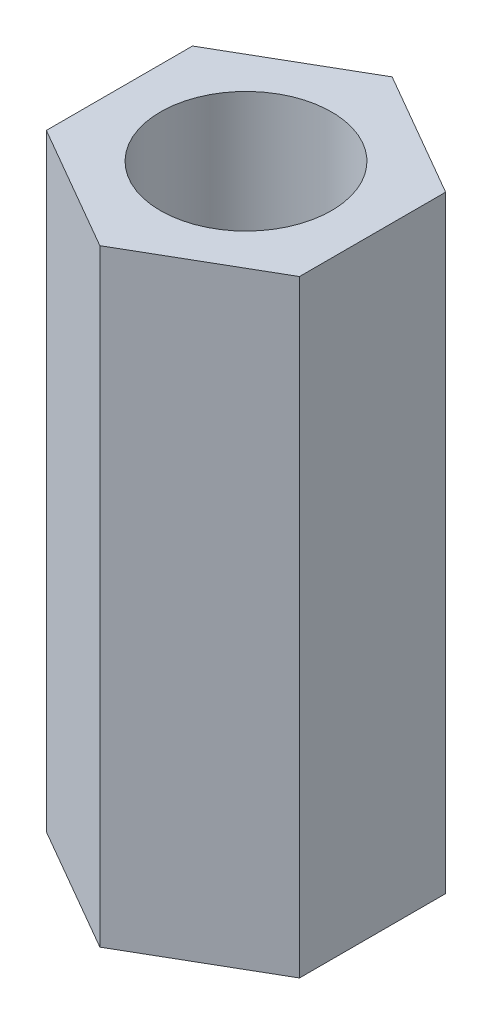
from build123d import *

# Parameters (mm, degrees)
SKETCH2_R           = 1.69
BOSS_EXTRUDE1_DEPTH = 12


with BuildPart() as part:
    # Sketch2 → Boss-Extrude1 (new body)
    with BuildSketch(Plane(origin=(0, 0, 0), x_dir=(1, 0, 0), z_dir=(0, 1, 0))):
        Polygon((0, 2.887), (2.500215341, 1.4435), (2.500215341, -1.4435), (0, -2.887), (-2.500215341, -1.4435), (-2.500215341, 1.4435), align=None)
        with Locations(Location((0, 0, 0), (0, 0, 270))):
            Circle(SKETCH2_R, mode=Mode.SUBTRACT)
    extrude(amount=BOSS_EXTRUDE1_DEPTH)


solid = part.part
